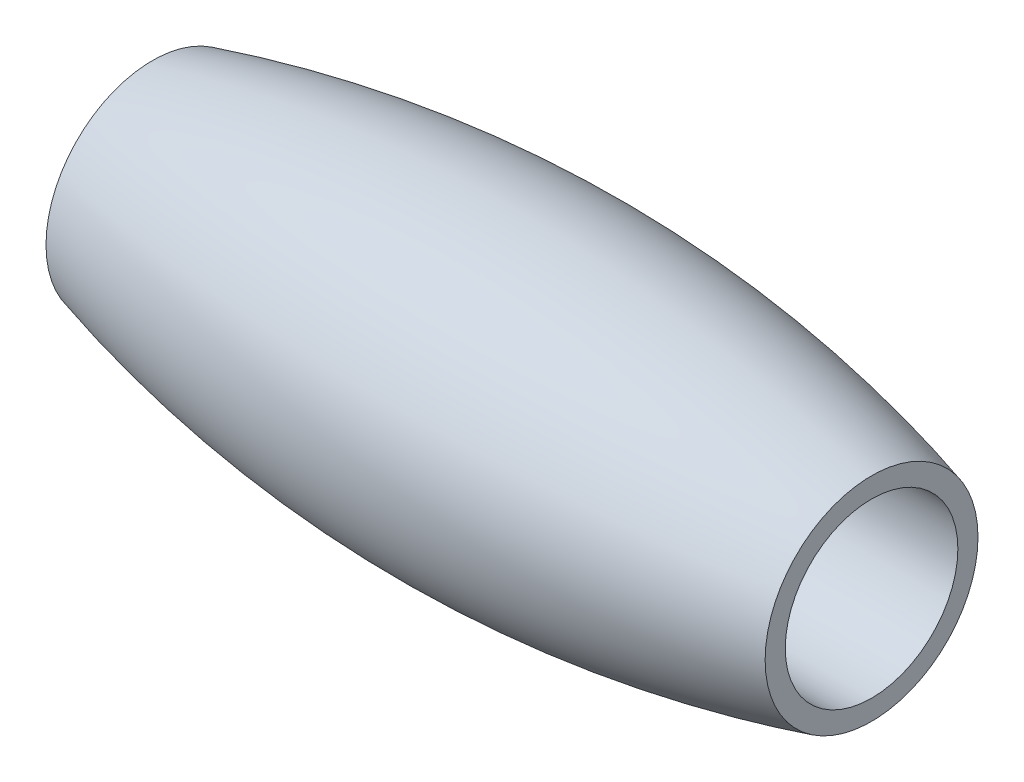
from build123d import *


with BuildPart() as part:
    # Sketch1 → Revolve1 (revolve)
    with BuildSketch(Plane(origin=(0, 0, 0), x_dir=(-1, 0, 0), z_dir=(0, 0, -1)), mode=Mode.PRIVATE) as revolve1_sk:
        with BuildLine():
            Line((-18.75, 5.55), (-18.75, 4.5))
            Line((-18.75, 4.5), (18.75, 4.5))
            Line((18.75, 4.5), (18.75, 5.55))
            ThreePointArc((18.75, 5.55), (0, 8.1), (-18.75, 5.55))
        make_face()
    revolve(revolve1_sk.sketch.rotate(Axis((18.75, 0, 0), (-1, 0, 0)), 270), axis=Axis((18.75, 0, 0), (-1, 0, 0)))


solid = part.part
